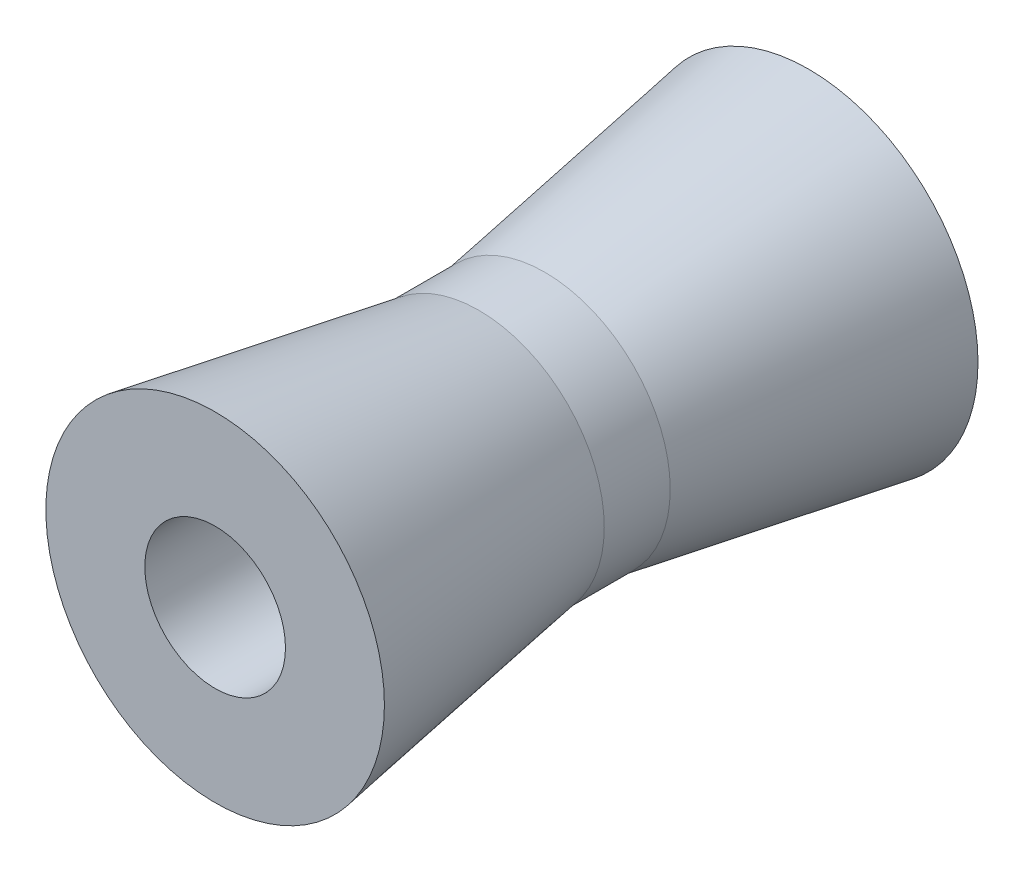
from build123d import *

# Parameters (mm, degrees)
ESQUISSE1_R        = 3.6195
ESQUISSE1_R_2      = 2.032
BOSS_EXTRU_1_DEPTH = 8.5725


with BuildPart() as part:
    # Esquisse1 → Boss.-Extru.1 (new, symmetric)
    with BuildSketch(Plane.XY):
        Circle(ESQUISSE1_R)
        Circle(ESQUISSE1_R_2, mode=Mode.SUBTRACT)
    extrude(amount=BOSS_EXTRU_1_DEPTH, both=True)

    # Esquisse4 → Révolution1 (revolve)
    with BuildSketch(Plane(origin=(0, 0, 0), x_dir=(0, 0, -1), z_dir=(1, 0, 0)), mode=Mode.PRIVATE) as r_volution1_sk:
        Polygon((0.9525, 3.6195), (8.5725, 4.8895), (8.5725, 3.6195), align=None)
    r_volution1 = revolve(r_volution1_sk.sketch.rotate(Axis((0, 0, 0), (0, 0, -1)), 270), axis=Axis((0, 0, 0), (0, 0, -1)))

    # Symétrie1: Révolution1 across plane
    add(r_volution1.mirror(Plane.XY))


solid = part.part
